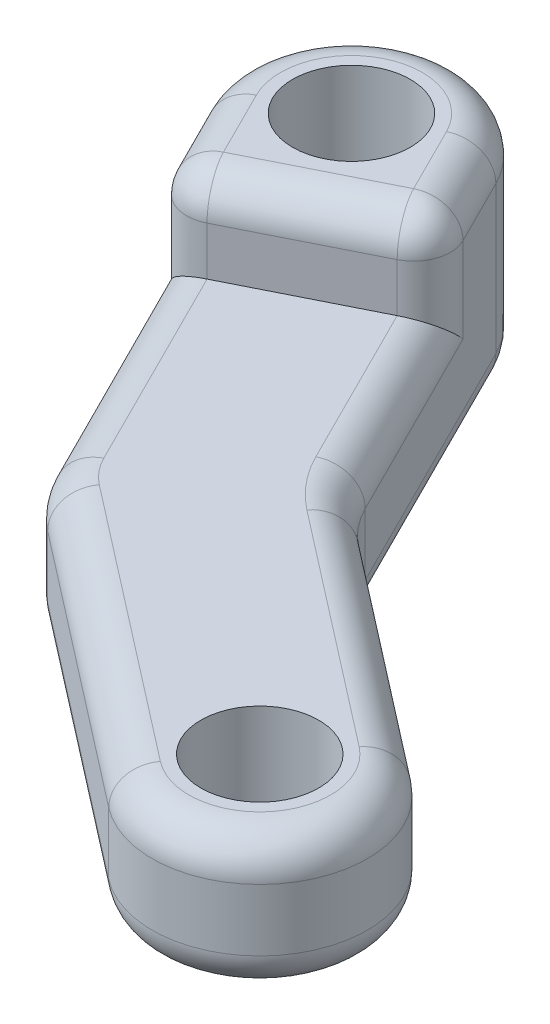
from build123d import *

# Parameters (mm, degrees)
SKETCH1_R           = 1.6000000000000019
SKETCH1_R_2         = 1.6
BOSS_EXTRUDE1_DEPTH = 6
FILLET2_R           = 1
CUT_EXTRUDE1_START  = -2.3175
SKETCH3_R           = 1.6
CUT_EXTRUDE1_DEPTH  = 2.3175
FILLET3_R           = 1
FILLET4_R           = 1


with BuildPart() as part:
    # Sketch1 → Boss-Extrude1 (new body)
    with BuildSketch(Plane(origin=(0, 0, 0), x_dir=(1, 0, 0), z_dir=(0, 1, 0))):
        with BuildLine():
            Line((-14.129644992635422, 12.695385617697283), (-9.976148994946639, 4.396395245283378))
            ThreePointArc((-9.976148994946639, 4.396395245283378), (-9.61073090700793, 3.833838918319386), (-9.129445521149016, 3.3665441747595697))
            Line((-9.129445521149016, 3.3665441747595697), (-1.790159058231558, -2.3132132513522183))
            ThreePointArc((-1.790159058231558, -2.3132132513522183), (2.313213251352219, -1.790159058231561), (1.790159058231562, 2.3132132513522174))
            Line((1.790159058231562, 2.3132132513522174), (-4.4947536043408105, 7.1770075109265346))
            ThreePointArc((-4.4947536043408105, 7.1770075109265346), (-4.976038990199725, 7.644302254486349), (-5.3414570781384345, 8.20685858145034))
            Line((-5.3414570781384345, 8.20685858145034), (-8.898255102266939, 15.313602532880296))
            ThreePointArc((-8.898255102266939, 15.313602532880296), (-12.823058505042685, 16.62018902047303), (-14.129644992635422, 12.695385617697283))
        make_face()
        with Locations(Location((-11.51395004745118, 14.00449407528879, 0), (0, 0, 270))):
            Circle(SKETCH1_R, mode=Mode.SUBTRACT)
        with Locations(Location((1.73e-15, -8.7e-16, 0), (0, 0, 270))):
            Circle(SKETCH1_R_2, mode=Mode.SUBTRACT)
    extrude(amount=BOSS_EXTRUDE1_DEPTH)

    # Fillet2
    fillet2_edges = [part.edges().sort_by_distance(p)[0] for p in [
        (-12.05289699379103, 0, -8.545890431490331),
        (-12.823058505042688, 0, -16.62018902047303),
        (-7.119856090202687, 0, -11.760230557165318),
        (-4.976038990199726, 0, -7.64430225448635),
        (-12.823058505042688, 6, -16.62018902047303),
        (-12.05289699379103, 6, -8.545890431490331),
        (-9.61073090700793, 6, -3.833838918319386),
        (-5.459802289690288, 6, -0.5266654617036757),
        (2.3132132513522197, 6, 1.7901590582315603),
        (-1.352297273054624, 6, -4.745110381139376),
        (-4.976038990199726, 6, -7.64430225448635),
        (-1.352297273054624, 0, -4.745110381139376),
        (-7.119856090202687, 6, -11.760230557165318),
        (2.3132132513522197, 0, 1.7901590582315603),
        (-5.459802289690288, 0, -0.5266654617036757),
        (-9.61073090700793, 0, -3.833838918319386),
    ]]
    fillet(fillet2_edges, radius=FILLET2_R)

    # Sketch3 → Cut-Extrude1 (cut)
    # profile 1 of 2: a face of its own
    with BuildSketch(Plane(origin=(0, 6, 0), x_dir=(1, 0, 0), z_dir=(0, 1, 0)).offset(CUT_EXTRUDE1_START)):
        with BuildLine():
            ThreePointArc((-5.106773795189211, 6.386165373712101), (-5.748487643001094, 7.009225031791857), (-6.2357117602527055, 7.75930013441051))
            Line((-6.235711760252705, 7.75930013441051), (-8.449834443261716, 12.183280039497655))
            Line((-8.449834443261715, 12.183280039497657), (-11.892714969401661, 10.460180018394306))
            Line((-11.89271496940166, 10.460180018394302), (-9.08189431283237, 4.843953692323209))
            ThreePointArc((-9.08189431283237, 4.84395369232321), (-8.838282254206565, 4.4689161410138825), (-8.517425330300622, 4.157386311974004))
            Line((-8.517425330300622, 4.157386311974004), (-1.1781388673831632, -1.5223711141377843))
            ThreePointArc((-1.1781388673831628, -1.522371114137784), (1.5223711141377851, -1.1781388673831652), (1.1781388673831665, 1.5223711141377825))
            Line((1.178138867383166, 1.5223711141377825), (-5.10677379518921, 6.386165373712102))
        make_face()
        with Locations(Location((1.73e-15, -8.7e-16, 0), (0, 0, 270))):
            Circle(SKETCH3_R, mode=Mode.SUBTRACT)
    # profile 2 of 2: a face of its own
    with BuildSketch(Plane(origin=(0, 6, 0), x_dir=(1, 0, 0), z_dir=(0, 1, 0)).offset(CUT_EXTRUDE1_START)):
        with BuildLine():
            Line((-8.449834443261716, 12.183280039497655), (-6.235711760252705, 7.75930013441051))
            ThreePointArc((-6.2357117602527055, 7.75930013441051), (-5.748487643001094, 7.009225031791857), (-5.106773795189211, 6.386165373712101))
            Line((-5.10677379518921, 6.386165373712102), (1.178138867383166, 1.5223711141377825))
            ThreePointArc((1.1781388673831665, 1.5223711141377825), (1.5223711141377851, -1.1781388673831652), (-1.1781388673831628, -1.522371114137784))
            Line((-1.1781388673831632, -1.5223711141377843), (-8.517425330300622, 4.157386311974004))
            ThreePointArc((-8.517425330300622, 4.157386311974004), (-8.838282254206565, 4.4689161410138825), (-9.08189431283237, 4.84395369232321))
            Line((-9.08189431283237, 4.843953692323209), (-11.89271496940166, 10.460180018394302))
            Line((-11.892714969401661, 10.460180018394306), (-12.78696965151593, 10.012621571354474))
            Line((-12.78696965151593, 10.012621571354474), (-9.976148994946639, 4.396395245283378))
            ThreePointArc((-9.976148994946639, 4.396395245283378), (-9.61073090700793, 3.8338389183193877), (-9.129445521149018, 3.3665441747595706))
            Line((-9.129445521149016, 3.3665441747595715), (-1.790159058231558, -2.3132132513522183))
            ThreePointArc((-1.7901590582315579, -2.313213251352218), (2.3132132513522183, -1.7901590582315614), (1.7901590582315636, 2.3132132513522152))
            Line((1.7901590582315636, 2.313213251352215), (-4.4947536043408105, 7.1770075109265346))
            ThreePointArc((-4.4947536043408105, 7.177007510926534), (-4.976038990199726, 7.64430225448635), (-5.3414570781384345, 8.20685858145034))
            Line((-5.3414570781384345, 8.20685858145034), (-7.555579761147449, 12.630838486537487))
            Line((-7.555579761147449, 12.630838486537487), (-8.449834443261715, 12.183280039497657))
        make_face()
    extrude(amount=CUT_EXTRUDE1_DEPTH, mode=Mode.SUBTRACT)

    # Fillet3
    fillet3_edges = [part.edges().sort_by_distance(p)[0] for p in [
        (-6.448518419642942, 3.6825, -10.418848533993913),
        (-4.976038990199726, 3.6825, -7.64430225448635),
        (-1.3522972730546234, 3.6825, -4.745110381139375),
        (-5.459802289690288, 3.6825, -0.5266654617036766),
        (-11.381559323231285, 3.6825, -7.204508408318926),
        (-9.61073090700793, 3.6825, -3.8338389183193873),
        (2.3132132513522183, 3.6825, 1.7901590582315612),
    ]]
    fillet(fillet3_edges, radius=FILLET3_R)

    # Fillet4
    fillet4_edges = [part.edges().sort_by_distance(p)[0] for p in [
        (-12.525048519232481, 5.707106781186548, -10.14370840551512),
        (-10.171274706331689, 6, -11.32173002894598),
        (-7.817500893430897, 5.707106781186548, -12.49975165237684),
        (-12.786969651515932, 3.84125, -10.012621571354474),
        (-7.555579761147449, 3.84125, -12.630838486537488),
    ]]
    fillet(fillet4_edges, radius=FILLET4_R)


solid = part.part
